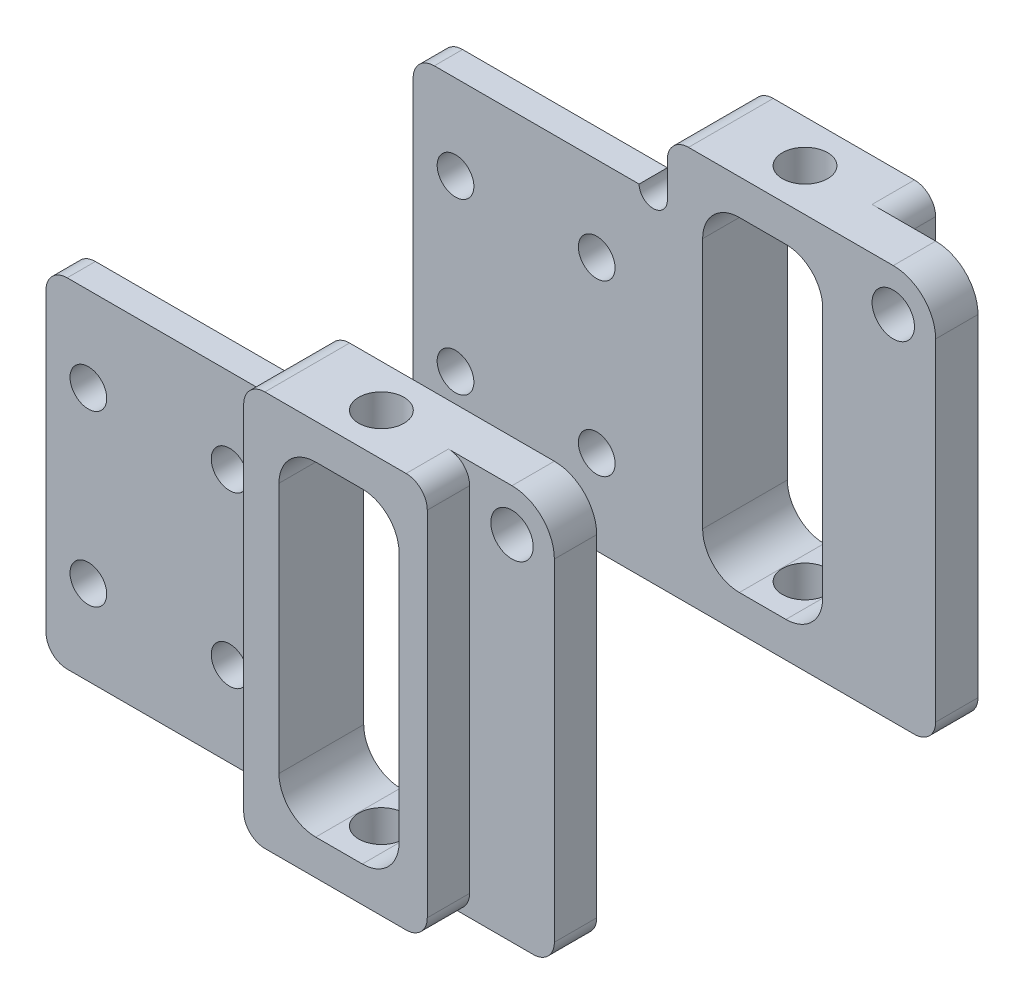
from build123d import *

# Parameters (mm, degrees)
SKETCH_3_R          = 1.5
SKETCH_3_R_2        = 1.3
EXTRUDE_1_DEPTH     = 2
SKETCH_4_R          = 1.5
EXTRUDE_2_DEPTH     = 4
SKETCH_5_R          = 1.6
CUT_EXTRUDE_1_DEPTH = 34
SKETCH_6_W          = 8.5
SKETCH_6_H          = 23
CUT_EXTRUDE_2_DEPTH = 34
FILLET_1_R          = 2.6
CUT_EXTRUDE_START   = -3
CUT_EXTRUDE_3_DEPTH = 3
FILLET_2_R          = 1.5
SKETCH_10_R         = 1
CUT_EXTRUDE_4_DEPTH = 4


with BuildPart() as part:
    # 草图3 → 凸台-拉伸1 (new body)
    with BuildSketch(Plane.XY):
        with BuildLine():
            Line((2, 19), (2, -5))
            Line((2, -5), (20, -5))
            Line((20, -5), (39, -5))
            Line((39, -5), (39, 20))
            ThreePointArc((39, 20), (38.121320344, 22.121320344), (36, 23))
            Line((36, 23), (20, 23))
            Line((20, 23), (20, 19))
            Line((20, 19), (2, 19))
        make_face()
        with Locations((36, 20)):
            Circle(SKETCH_3_R, mode=Mode.SUBTRACT)
        with Locations((15, 13)):
            Circle(SKETCH_3_R_2, mode=Mode.SUBTRACT)
        with Locations((5, 13)):
            Circle(SKETCH_3_R_2, mode=Mode.SUBTRACT)
        with Locations((5, 1)):
            Circle(SKETCH_3_R_2, mode=Mode.SUBTRACT)
        with Locations((15, 1)):
            Circle(SKETCH_3_R_2, mode=Mode.SUBTRACT)
    extrude(amount=EXTRUDE_1_DEPTH)

    # 草图4 → 凸台-拉伸2 (add)
    with BuildSketch(Plane.XY.offset(2)):
        with BuildLine():
            Line((39, -5), (20, -5))
            Line((20, -5), (20, 23))
            Line((20, 23), (36, 23))
            ThreePointArc((36, 23), (38.121320344, 22.121320344), (39, 20))
            Line((39, 20), (39, -5))
        make_face()
        with Locations((36, 20)):
            Circle(SKETCH_4_R, mode=Mode.SUBTRACT)
    extrude(amount=EXTRUDE_2_DEPTH)

    # 草图5 → 切除-拉伸1 (cut)
    with BuildSketch(Plane(origin=(0, 23, 0), x_dir=(1, 0, 0), z_dir=(0, 1, 0))):
        with Locations(Location((26.75, -3, 0), (0, 0, 270))):
            Circle(SKETCH_5_R)
    extrude(amount=-CUT_EXTRUDE_1_DEPTH, mode=Mode.SUBTRACT)

    # 草图6 → 切除-拉伸2 (cut)
    with BuildSketch(Plane.XY.offset(6)):
        with Locations((26.75, 9)):
            Rectangle(SKETCH_6_W, SKETCH_6_H)
    extrude(amount=-CUT_EXTRUDE_2_DEPTH, mode=Mode.SUBTRACT)

    # 圆角1
    fillet_1_edges = [part.edges().sort_by_distance(p)[0] for p in [
        (22.5, 20.5, 3),
        (31, -2.5, 3),
        (22.5, -2.5, 3),
        (31, 20.5, 3),
    ]]
    fillet(fillet_1_edges, radius=FILLET_1_R)

    # 草图7 → 切除-拉伸3 (cut)
    with BuildSketch(Plane.XY.offset(6).offset(CUT_EXTRUDE_START)):
        with BuildLine():
            Line((33, 23), (33, -5))
            Line((33, -5), (39, -5))
            Line((39, -5), (39, 20))
            ThreePointArc((39, 20), (38.121320344, 22.121320344), (36, 23))
            Line((36, 23), (33, 23))
        make_face()
    extrude(amount=CUT_EXTRUDE_3_DEPTH, mode=Mode.SUBTRACT)

    # 圆角2
    fillet_2_edges = [part.edges().sort_by_distance(p)[0] for p in [
        (39, -5, 1.5),
        (33, 23, 4.5),
        (33, -5, 4.5),
        (20, 23, 3),
        (2, -5, 1),
        (2, 19, 1),
        (20, -5, 4),
    ]]
    fillet(fillet_2_edges, radius=FILLET_2_R)

    # 草图10 → 切除-拉伸4 (cut)
    with BuildSketch(Plane.XY.offset(2)):
        with Locations((19, 19)):
            Circle(SKETCH_10_R)
    extrude(amount=-CUT_EXTRUDE_4_DEPTH, mode=Mode.SUBTRACT)


with BuildPart() as body_2:
    # 镜向1: mirrored copy
    add(part.part.mirror(Plane(origin=(0, 0, -12), x_dir=(1, 0, 0), z_dir=(0, 0, -1))))


solid = Compound([part.part, body_2.part])
